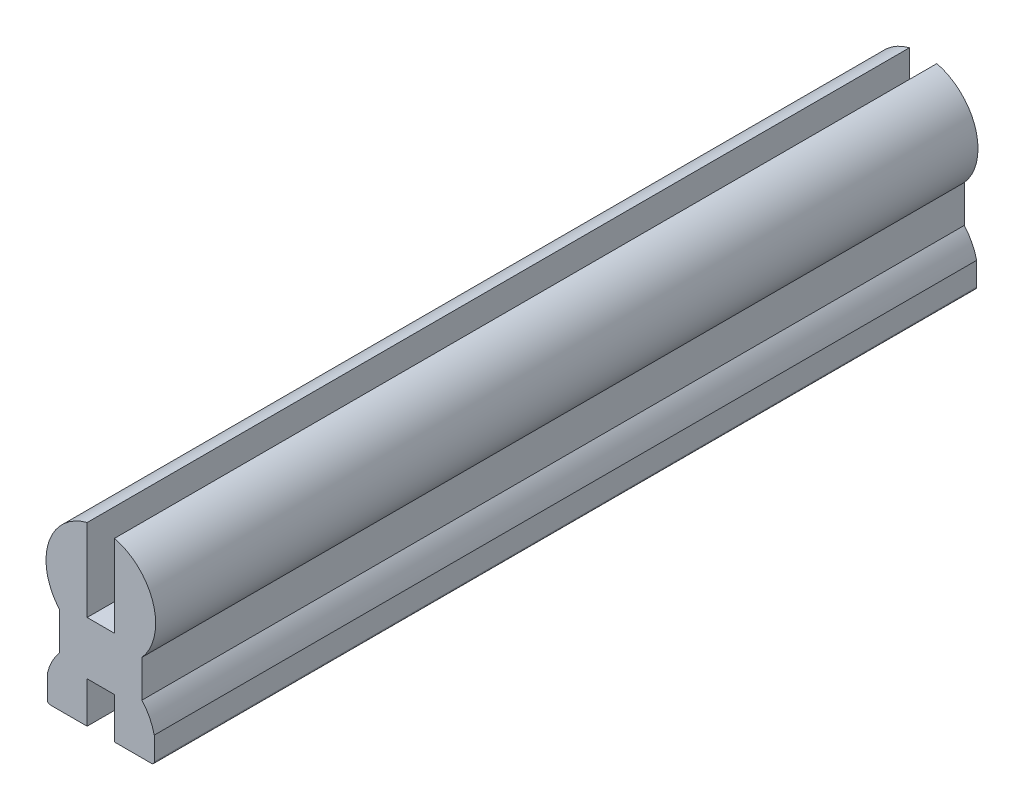
from build123d import *

# Parameters (mm, degrees)
EXTRUDE_1_DEPTH = 30
FILLET_1_R      = 0.1


with BuildPart() as part:
    # 草图1 → 凸台-拉伸1 (new body)
    with BuildSketch(Plane.XY):
        with BuildLine():
            Line((-1.95, -2.5), (-0.5, -2.5))
            Line((-0.5, -2.5), (-0.5, -1))
            Line((-0.5, -1), (0.5, -1))
            Line((0.5, -1), (0.5, -2.5))
            Line((0.5, -2.5), (1.95, -2.5))
            Line((1.95, -2.5), (1.95, -1.555590279))
            ThreePointArc((1.95, -1.555590279), (1.780042303, -1.088161527), (1.5, -0.677124344))
            Line((1.5, -0.677124344), (1.5, 0.677124344))
            ThreePointArc((1.5, 0.677124344), (1.912032648, 2.586626929), (0.5, 3.936491673))
            Line((0.5, 3.936491673), (0.5, 0.936491673))
            Line((0.5, 0.936491673), (-0.5, 0.936491673))
            Line((-0.5, 0.936491673), (-0.5, 3.936491673))
            ThreePointArc((-0.5, 3.936491673), (-1.912032648, 2.586626929), (-1.5, 0.677124344))
            Line((-1.5, 0.677124344), (-1.5, -0.677124344))
            ThreePointArc((-1.5, -0.677124344), (-1.780042303, -1.088161527), (-1.95, -1.555590279))
            Line((-1.95, -1.555590279), (-1.95, -2.5))
        make_face()
    extrude(amount=-EXTRUDE_1_DEPTH)

    # 圆角1
    fillet_1_edges = [part.edges().sort_by_distance(p)[0] for p in [
        (1.95, -2.5, -15),
        (-1.95, -2.5, -15),
    ]]
    fillet(fillet_1_edges, radius=FILLET_1_R)


solid = part.part
